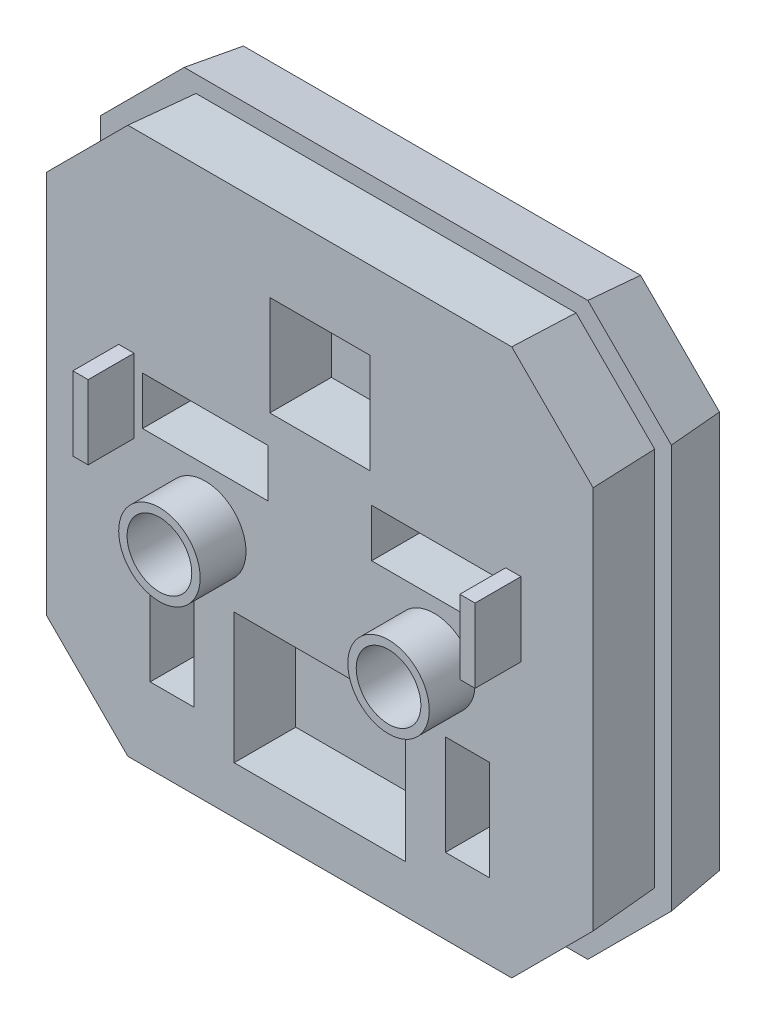
from build123d import *

# Parameters (mm, degrees)
SKETCH1_R           = 12.7
SKETCH1_W           = 98
SKETCH1_H           = 16
BOSS_EXTRUDE1_DEPTH = 22
BOSS_EXTRUDE1_DRAFT = -8
SKETCH2_R           = 12.7
SKETCH2_W           = 56
SKETCH2_H           = 25.6
SKETCH2_W_2         = 46
SKETCH2_H_2         = 46
SKETCH2_W_3         = 74
SKETCH2_H_3         = 58
SKETCH2_W_4         = 24
BOSS_EXTRUDE2_DEPTH = 48
BOSS_EXTRUDE2_DRAFT = -4
SKETCH3_R           = 16
SKETCH3_R_2         = 12.7
SKETCH3_W           = 6
SKETCH3_H           = 29
BOSS_EXTRUDE3_DEPTH = 66


with BuildPart() as part:
    # Sketch1 → Boss-Extrude1 (with draft: the straight prism first)
    with BuildSketch(Plane.XY):
        Polygon((-78, 109), (-109, 78), (-109, -78), (-78, -109), (78, -109), (109, -78), (109, 78), (78, 109), align=None)
        with Locations((-45, -14.5)):
            Circle(SKETCH1_R, mode=Mode.SUBTRACT)
        with Locations((45, -14.5)):
            Circle(SKETCH1_R, mode=Mode.SUBTRACT)
        with Locations((0, 94)):
            Rectangle(SKETCH1_W, SKETCH1_H, mode=Mode.SUBTRACT)
    extrude(amount=BOSS_EXTRUDE1_DEPTH)
    # Boss-Extrude1: the draft: its side faces are tilted about the plane it starts from
    boss_extrude1_sides = [part.faces().sort_by_distance(p)[0] for p in [
        (-93.5, 93.5, 11),
        (-109, 0, 11),
        (-93.5, -93.5, 11),
        (0, -109, 11),
        (93.5, -93.5, 11),
        (109, 0, 11),
        (93.5, 93.5, 11),
        (0, 109, 11),
        (-57.7, -14.5, 11),
        (32.3, -14.5, 11),
        (-49, 94, 11),
        (0, 102, 11),
        (49, 94, 11),
        (0, 86, 11),
    ]]
    draft(boss_extrude1_sides, Plane.XY, BOSS_EXTRUDE1_DRAFT)


with BuildPart() as boss_extrude2_tool:
    # Sketch2 → Boss-Extrude2 (with draft: the straight prism first)
    with BuildSketch(Plane.XY):
        Polygon((-74, 104), (-104, 74), (-104, -74), (-74, -104), (74, -104), (104, -74), (104, 74), (74, 104), align=None)
        with Locations((-45, -14.5)):
            Circle(SKETCH2_R, mode=Mode.SUBTRACT)
        with Locations((45, -14.5)):
            Circle(SKETCH2_R, mode=Mode.SUBTRACT)
        with Locations((-45, 16.5)):
            Rectangle(SKETCH2_W, SKETCH2_H, mode=Mode.SUBTRACT)
        with Locations((45, 16.5)):
            Rectangle(SKETCH2_W, SKETCH2_H, mode=Mode.SUBTRACT)
        with Locations((0, 57)):
            Rectangle(SKETCH2_W_2, SKETCH2_H_2, mode=Mode.SUBTRACT)
        with Locations((0, -63)):
            Rectangle(SKETCH2_W_3, SKETCH2_H_3, mode=Mode.SUBTRACT)
        with Locations((-58, -58)):
            Rectangle(SKETCH2_W_4, SKETCH2_H_2, mode=Mode.SUBTRACT)
        with Locations((58, -58)):
            Rectangle(SKETCH2_W_4, SKETCH2_H_2, mode=Mode.SUBTRACT)
    extrude(amount=BOSS_EXTRUDE2_DEPTH)
    # Boss-Extrude2: the draft: its side faces are tilted about the plane it starts from
    boss_extrude2_sides = [boss_extrude2_tool.faces().sort_by_distance(p)[0] for p in [
        (-89, 89, 24),
        (-104, 0, 24),
        (-89, -89, 24),
        (0, -104, 24),
        (89, -89, 24),
        (104, 0, 24),
        (89, 89, 24),
        (0, 104, 24),
        (-57.7, -14.5, 24),
        (32.3, -14.5, 24),
        (-73, 16.5, 24),
        (-45, 29.3, 24),
        (-17, 16.5, 24),
        (-45, 3.7, 24),
        (17, 16.5, 24),
        (45, 29.3, 24),
        (73, 16.5, 24),
        (45, 3.7, 24),
        (-23, 57, 24),
        (0, 80, 24),
        (23, 57, 24),
        (0, 34, 24),
        (-37, -63, 24),
        (0, -34, 24),
        (37, -63, 24),
        (0, -92, 24),
        (-70, -58, 24),
        (-58, -35, 24),
        (-46, -58, 24),
        (-58, -81, 24),
        (46, -58, 24),
        (58, -35, 24),
        (70, -58, 24),
        (58, -81, 24),
    ]]
    draft(boss_extrude2_sides, Plane.XY, BOSS_EXTRUDE2_DRAFT)


with BuildPart() as part_1:
    add(part.part)

    # Boss-Extrude2: add boss_extrude2_tool
    add(boss_extrude2_tool.part)

    # Sketch3 → Boss-Extrude3 (add)
    # profile 1 of 4: a face of its own
    with BuildSketch(Plane.XY):
        with Locations(Location((-45, -14.5, 0), (0, 0, 180))):
            Circle(SKETCH3_R)
        with Locations(Location((-45, -14.5, 0), (0, 0, 180))):
            Circle(SKETCH3_R_2, mode=Mode.SUBTRACT)
    # profile 2 of 4: a face of its own
    with BuildSketch(Plane.XY):
        with Locations(Location((45, -14.5, 0), (0, 0, 180))):
            Circle(SKETCH3_R)
        with Locations(Location((45, -14.5, 0), (0, 0, 180))):
            Circle(SKETCH3_R_2, mode=Mode.SUBTRACT)
    # profile 3 of 4: a face of its own
    with BuildSketch(Plane.XY):
        with Locations((-76, 16.5)):
            Rectangle(SKETCH3_W, SKETCH3_H)
    # profile 4 of 4: a face of its own
    with BuildSketch(Plane.XY):
        with Locations((76, 16.5)):
            Rectangle(SKETCH3_W, SKETCH3_H)
    extrude(amount=BOSS_EXTRUDE3_DEPTH)


solid = part_1.part
